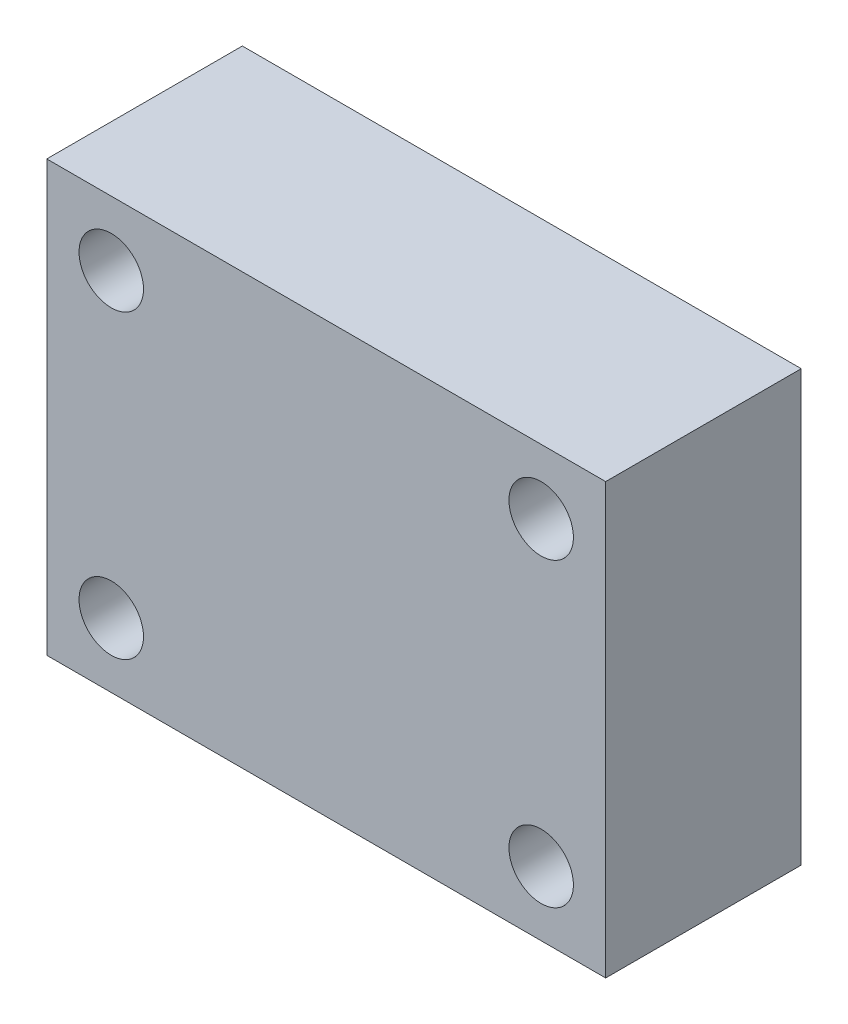
from build123d import *

# Parameters (mm, degrees)
SKETCH1_W           = 52
SKETCH1_H           = 40
SKETCH1_R           = 3
BOSS_EXTRUDE1_DEPTH = 18.19490677


with BuildPart() as part:
    # Sketch1 → Boss-Extrude1 (new body)
    with BuildSketch(Plane.XY):
        with Locations((26, -20)):
            Rectangle(SKETCH1_W, SKETCH1_H)
        with Locations((6, -6)):
            Circle(SKETCH1_R, mode=Mode.SUBTRACT)
        with Locations((46, -6)):
            Circle(SKETCH1_R, mode=Mode.SUBTRACT)
        with Locations((6, -34)):
            Circle(SKETCH1_R, mode=Mode.SUBTRACT)
        with Locations((46, -34)):
            Circle(SKETCH1_R, mode=Mode.SUBTRACT)
    extrude(amount=BOSS_EXTRUDE1_DEPTH)


solid = part.part
